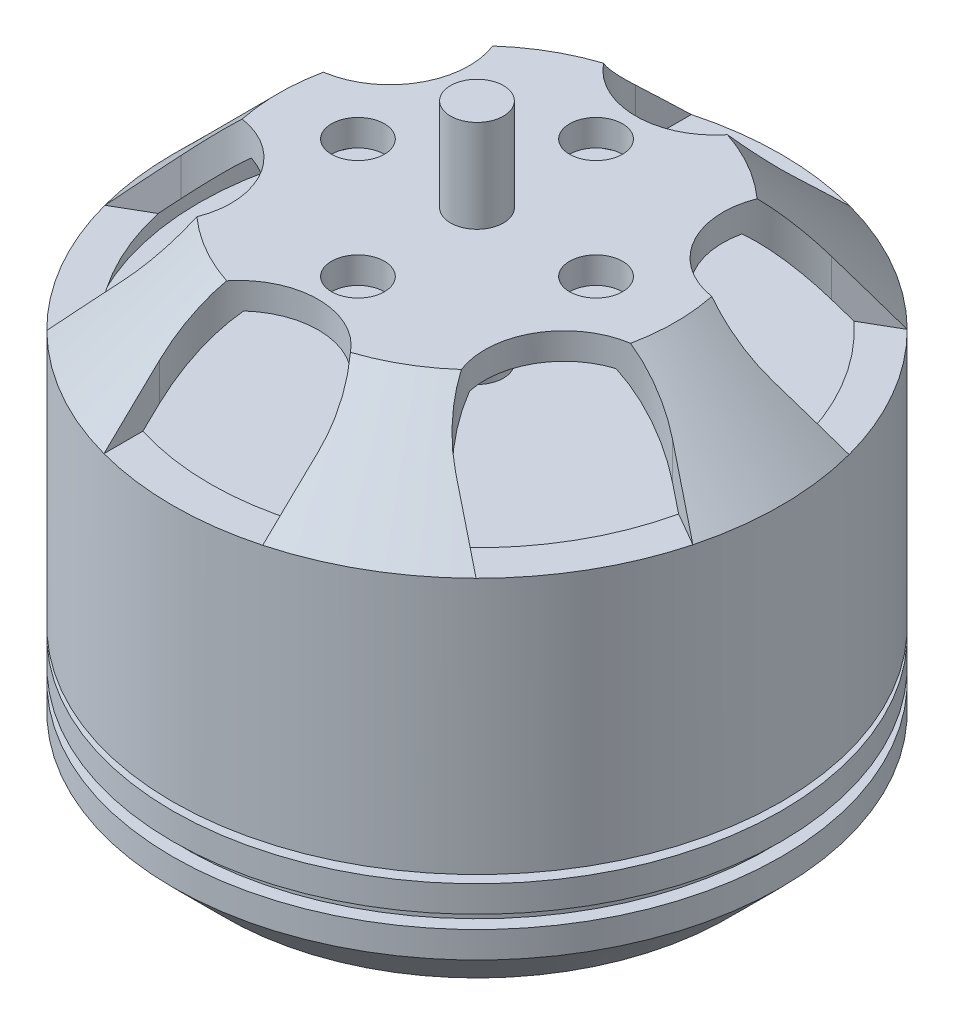
from build123d import *

# Parameters (mm, degrees)
SKETCH2_R          = 1
CUT_EXTRUDE1_DEPTH = 4
SKETCH4_R          = 1
CUT_EXTRUDE3_DEPTH = 3


with BuildPart() as part:
    # Sketch1 → Revolve1 (revolve)
    with BuildSketch(Plane.XY, mode=Mode.PRIVATE) as revolve1_sk:
        Polygon((0, 22), (0, -1.8), (1, -1.8), (1, 0), (9.5, 0), (11.5, 2), (11.5, 3), (11, 3), (11, 3.5), (11.5, 3.5), (11.5, 4.5), (9.5, 4.5), (9.5, 4.8), (11.5, 4.8), (11.5, 14.5), (7.5, 18.5), (1, 18.5), (1, 22), align=None)
        Polygon((1, 16.5), (1, 13.419161277), (10.5, 13.419161277), (10.5, 14.085786438), (7.085786438, 17.5), (2, 17.5), (2, 16.5), align=None, mode=Mode.SUBTRACT)
    revolve(revolve1_sk.sketch.rotate(Axis((0, 22, 0), (0, -1, 0)), 180), axis=Axis((0, 22, 0), (0, -1, 0)))

    # Sketch2 → Cut-Extrude1 (cut)
    with BuildSketch(Plane(origin=(0, 18.5, 0), x_dir=(1, 0, 0), z_dir=(0, 1, 0))):
        with Locations(Location((0, 4.5, 0), (0, 0, 180))):
            Circle(SKETCH2_R)
        with Locations(Location((4.5, 0, 0), (0, 0, 180))):
            Circle(SKETCH2_R)
        with Locations(Location((0, -4.5, 0), (0, 0, 180))):
            Circle(SKETCH2_R)
        with Locations(Location((-4.5, 0, 0), (0, 0, 180))):
            Circle(SKETCH2_R)
        with BuildLine():
            Line((-3, 9), (-3, 13.152327235))
            Line((-3, 13.152327235), (3, 13.152327235))
            Line((3, 13.152327235), (3, 9))
            ThreePointArc((3, 9), (0, 6), (-3, 9))
        make_face()
        with BuildLine():
            Line((12.890249504, 3.978087406), (9.294228634, 1.901923789))
            ThreePointArc((9.294228634, 1.901923789), (5.196152423, 3), (6.294228634, 7.098076211))
            Line((6.294228634, 7.098076211), (9.890249504, 9.174239829))
            Line((9.890249504, 9.174239829), (12.890249504, 3.978087406))
        make_face()
        with BuildLine():
            Line((9.890249504, -9.174239829), (6.294228634, -7.098076211))
            ThreePointArc((6.294228634, -7.098076211), (5.196152423, -3), (9.294228634, -1.901923789))
            Line((9.294228634, -1.901923789), (12.890249504, -3.978087406))
            Line((12.890249504, -3.978087406), (9.890249504, -9.174239829))
        make_face()
        with BuildLine():
            Line((-3, -13.152327235), (-3, -9))
            ThreePointArc((-3, -9), (0, -6), (3, -9))
            Line((3, -9), (3, -13.152327235))
            Line((3, -13.152327235), (-3, -13.152327235))
        make_face()
        with BuildLine():
            Line((-12.890249504, -3.978087406), (-9.294228634, -1.901923789))
            ThreePointArc((-9.294228634, -1.901923789), (-5.196152423, -3), (-6.294228634, -7.098076211))
            Line((-6.294228634, -7.098076211), (-9.890249504, -9.174239829))
            Line((-9.890249504, -9.174239829), (-12.890249504, -3.978087406))
        make_face()
        with BuildLine():
            Line((-9.890249504, 9.174239829), (-6.294228634, 7.098076211))
            ThreePointArc((-6.294228634, 7.098076211), (-5.196152423, 3), (-9.294228634, 1.901923789))
            Line((-9.294228634, 1.901923789), (-12.890249504, 3.978087406))
            Line((-12.890249504, 3.978087406), (-9.890249504, 9.174239829))
        make_face()
    extrude(amount=-CUT_EXTRUDE1_DEPTH, mode=Mode.SUBTRACT)

    # Sketch4 → Cut-Extrude3 (cut)
    with BuildSketch(Plane.XZ):
        with Locations((0, 6)):
            Circle(SKETCH4_R)
        with Locations((0, -6)):
            Circle(SKETCH4_R)
        with Locations((-8, 0)):
            Circle(SKETCH4_R)
        with Locations((8, 0)):
            Circle(SKETCH4_R)
    extrude(amount=-CUT_EXTRUDE3_DEPTH, mode=Mode.SUBTRACT)


solid = part.part
